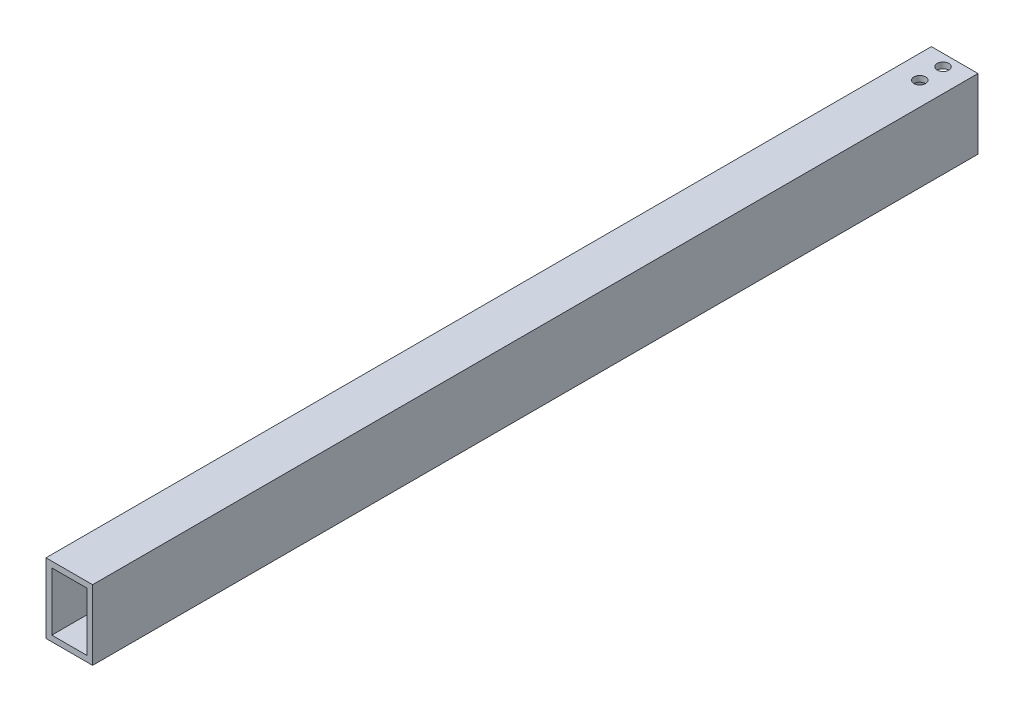
from build123d import *

# Parameters (mm, degrees)
SKETCH1_W           = 25.4
SKETCH1_H           = 38.1
SKETCH1_W_2         = 19.05
SKETCH1_H_2         = 31.75
BOSS_EXTRUDE1_DEPTH = 482.6
SKETCH2_R           = 3.175
CUT_EXTRUDE1_DEPTH  = 485.268169509


with BuildPart() as part:
    # Sketch1 → Boss-Extrude1 (new body)
    with BuildSketch(Plane.XY):
        Rectangle(SKETCH1_W, SKETCH1_H)
        Rectangle(SKETCH1_W_2, SKETCH1_H_2, mode=Mode.SUBTRACT)
    extrude(amount=BOSS_EXTRUDE1_DEPTH)

    # Sketch2 → Cut-Extrude1 (cut, through all)
    with BuildSketch(Plane(origin=(0, 19.05, 0), x_dir=(1, 0, 0), z_dir=(0, 1, 0))):
        with Locations(Location((0, -19.05, 0), (0, 0, 270))):
            Circle(SKETCH2_R)
        with Locations(Location((0, -6.35, 0), (0, 0, 270))):
            Circle(SKETCH2_R)
    extrude(amount=-CUT_EXTRUDE1_DEPTH, mode=Mode.SUBTRACT)


solid = part.part
